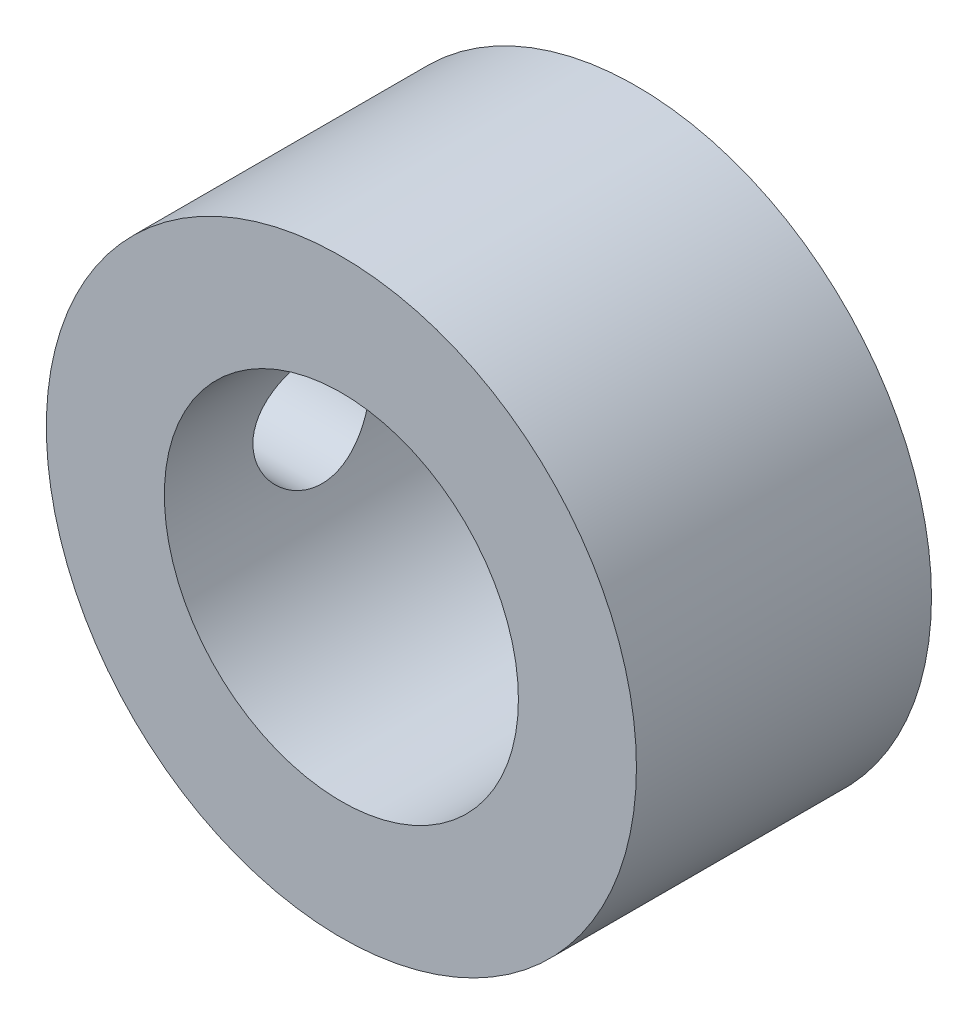
from build123d import *

# Parameters (mm, degrees)
SKIZZE1_R                       = 10
SKIZZE1_R_2                     = 6
AUFSATZ_LINEAR_AUSTRAGEN1_DEPTH = 10
SKIZZE2_R                       = 2
SCHNITT_LINEAR_AUSTRAGEN1_DEPTH = 18


with BuildPart() as part:
    # Skizze1 → Aufsatz-Linear austragen1 (new body)
    with BuildSketch(Plane.XY):
        Circle(SKIZZE1_R)
        Circle(SKIZZE1_R_2, mode=Mode.SUBTRACT)
    extrude(amount=AUFSATZ_LINEAR_AUSTRAGEN1_DEPTH)

    # Skizze2 → Schnitt-Linear austragen1 (cut)
    with BuildSketch(Plane(origin=(0, 0, 0), x_dir=(0, 0, -1), z_dir=(1, 0, 0))):
        with Locations(Location((-5, 0, 0), (0, 0, 180))):
            Circle(SKIZZE2_R)
    extrude(amount=-SCHNITT_LINEAR_AUSTRAGEN1_DEPTH, mode=Mode.SUBTRACT)


solid = part.part
